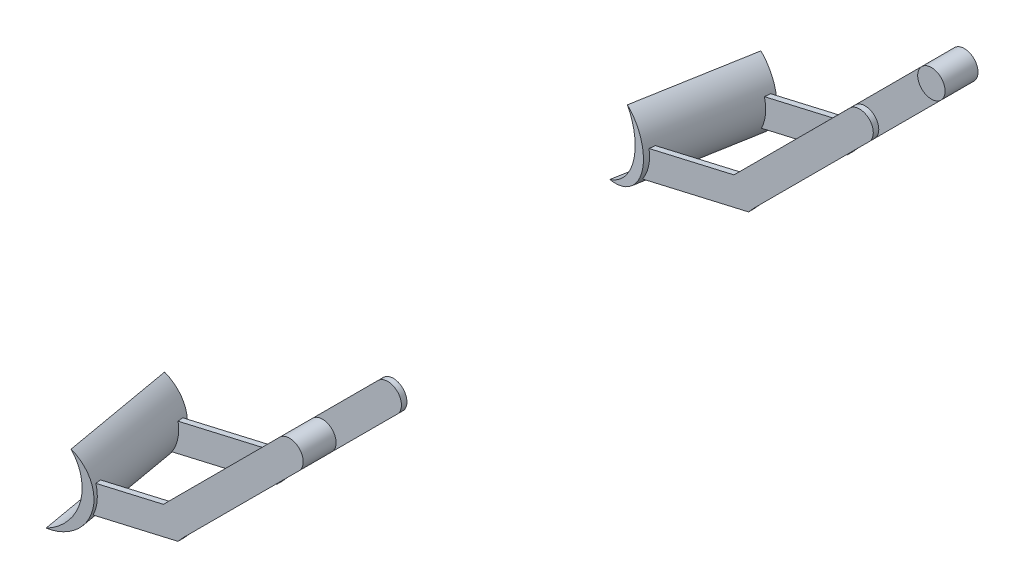
from build123d import *
from build123d.topology import SkipClean

# Parameters (mm, degrees)
BOSS_EXTRUDE1_DEPTH      = 10
BOSS_EXTRUDE2_START      = 50
SKETCH4_R                = 25
BOSS_EXTRUDE2_DEPTH      = 50
BOSS_EXTRUDE3_DEPTH      = 10
BOSS_EXTRUDE3_DEPTH_BACK = 200
BOSS_EXTRUDE4_DEPTH      = 10


with BuildPart() as part:
    # Sketch2 → Boss-Extrude1 (new body)
    with BuildSketch(Plane.XY):
        with BuildLine():
            Line((-17.67766953, 17.67766953), (-229.809703886, -194.454364826))
            Line((-229.809703886, -194.454364826), (-364.717660886, -225.600320827))
            Line((-364.717660886, -225.600320827), (-364.717660886, -276.915526217))
            Line((-364.717660886, -276.915526217), (-218.562151168, -243.172868066))
            Line((-218.562151168, -243.172868066), (-203.201266101, -239.626528316))
            Line((-203.201266101, -239.626528316), (-192.652462612, -227.910895144))
            Line((-192.652462612, -227.910895144), (17.67766953, -17.67766953))
            ThreePointArc((17.67766953, -17.67766953), (17.67766953, 17.67766953), (-17.67766953, 17.67766953))
        make_face()
    extrude(amount=BOSS_EXTRUDE1_DEPTH)

    # Sketch4 → Boss-Extrude2 (add)
    with SkipClean():  # the faces are left unmerged after this step: merging them gives an invalid solid
        with BuildSketch(Plane(origin=(0, 0, 0), x_dir=(-1, 0, 0), z_dir=(0, 0, -1)).offset(BOSS_EXTRUDE2_START)):
            Circle(SKETCH4_R)
        extrude(amount=-BOSS_EXTRUDE2_DEPTH)

    # Sketch8 → Boss-Extrude3 (add, two sides: drawn at the far end of the back side and taken through both)
    with SkipClean():  # the faces are left unmerged after this step: merging them gives an invalid solid
        with BuildSketch(Plane(origin=(-9.287482424, 0, -52.671930221), x_dir=(0, -1, 0), z_dir=(0.173648177666934, 0, 0.9848077530122075)).offset(-BOSS_EXTRUDE3_DEPTH_BACK)):
            with BuildLine():
                ThreePointArc((177.730965122, -382.620384791), (257.574654139, -368.770911493), (318.547687963, -422.14798272))
                ThreePointArc((318.547687963, -422.14798272), (262.996456529, -349.455787773), (177.730965122, -382.620384791))
            make_face()
        extrude(amount=BOSS_EXTRUDE3_DEPTH + BOSS_EXTRUDE3_DEPTH_BACK)

    # Sketch9 → Boss-Extrude4 (add)
    with SkipClean():  # the faces are left unmerged after this step: merging them gives an invalid solid
        with BuildSketch(Plane(origin=(0, 0, -170), x_dir=(-1, 0, 0), z_dir=(0, 0, -1))):
            with BuildLine():
                Line((395.452614899, -284.011249454), (395.452614899, -232.696044065))
                Line((395.452614899, -232.696044065), (229.809703886, -194.454364826))
                Line((229.809703886, -194.454364826), (19.479571744, 15.778860788))
                ThreePointArc((19.479571744, 15.778860788), (-15.827314052, 17.629216266), (-17.67766953, -17.67766953))
                Line((-17.67766953, -17.67766953), (192.652462612, -227.910895144))
                Line((192.652462612, -227.910895144), (203.201266101, -239.626528316))
                Line((203.201266101, -239.626528316), (395.452614899, -284.011249454))
            make_face()
        extrude(amount=BOSS_EXTRUDE4_DEPTH)


with BuildPart() as body_2:
    # Mirror6: mirrored copy
    add(part.part.mirror(Plane(origin=(0, 0, -605), x_dir=(1, 0, 0), z_dir=(0, 0, -1))))


solid = Compound([part.part, body_2.part])
